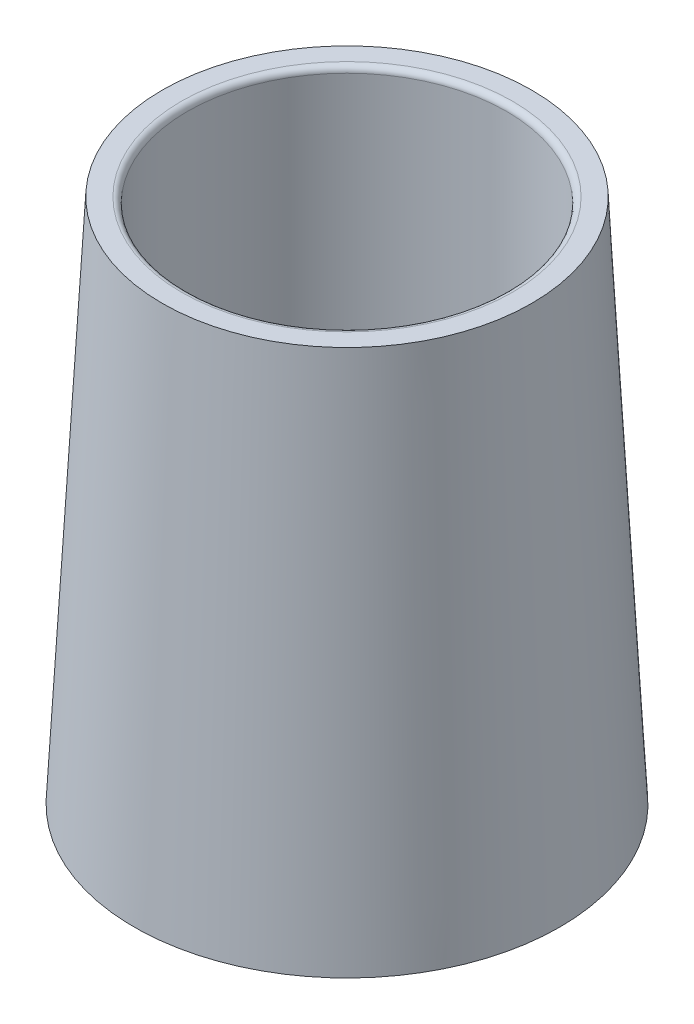
from build123d import *

# Parameters (mm, degrees)
SKETCH_2_R          = 27
CUT_EXTRUDE_1_DEPTH = 66
SKETCH_3_R          = 28.9
CUT_EXTRUDE_2_DEPTH = 11
SKETCH_4_R          = 23
CUT_EXTRUDE_3_DEPTH = 94.145048178
FILLET_1_R          = 1
FILLET_3_R          = 1


with BuildPart() as part:
    # 草圖1 → 旋轉1 (revolve)
    with BuildSketch(Plane.XY, mode=Mode.PRIVATE) as revolve_1_sk:
        Polygon((0, 0), (36, 0), (31.25, 89), (0, 89), align=None)
    revolve(revolve_1_sk.sketch.rotate(Axis((0, 89, 0), (0, -1, 0)), 180), axis=Axis((0, 89, 0), (0, -1, 0)))

    # 草圖2 → 除料-伸長1 (cut)
    with BuildSketch(Plane(origin=(0, 89, 0), x_dir=(1, 0, 0), z_dir=(0, 1, 0))):
        with Locations(Location((0, 0, 0), (0, 0, 180))):
            Circle(SKETCH_2_R)
    extrude(amount=-CUT_EXTRUDE_1_DEPTH, mode=Mode.SUBTRACT)

    # 草圖3 → 除料-伸長2 (cut)
    with BuildSketch(Plane.XZ):
        Circle(SKETCH_3_R)
    extrude(amount=-CUT_EXTRUDE_2_DEPTH, mode=Mode.SUBTRACT)

    # 草圖4 → 除料-伸長3 (cut, through all)
    with BuildSketch(Plane.XZ.offset(-11)):
        Circle(SKETCH_4_R)
    extrude(amount=-CUT_EXTRUDE_3_DEPTH, mode=Mode.SUBTRACT)

    # 圓角1
    fillet_1_edges = [part.edges().sort_by_distance(p)[0] for p in [
        (27, 89, 0),
    ]]
    fillet(fillet_1_edges, radius=FILLET_1_R)

    # 圓角3
    fillet_3_edges = [part.edges().sort_by_distance(p)[0] for p in [
        (-23, 23, 0),
        (-23, 11, 0),
    ]]
    fillet(fillet_3_edges, radius=FILLET_3_R)


solid = part.part
